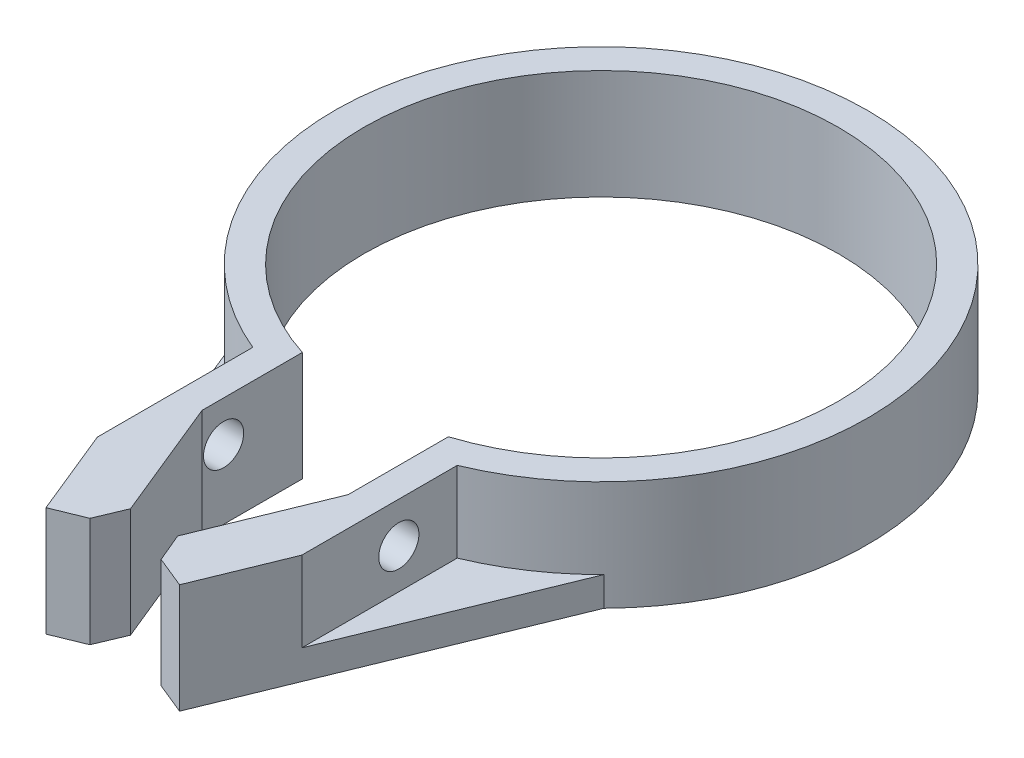
from build123d import *

# Parameters (mm, degrees)
BOSS_EXTRUDE1_DEPTH = 15
BOSS_EXTRUDE2_DEPTH = 4
CUT_EXTRUDE1_DEPTH  = 4
BOSS_EXTRUDE3_DEPTH = 15
CHAMFER1_SIZE       = 3
SKETCH6_R           = 2.75
CUT_EXTRUDE2_DEPTH  = 50


with BuildPart() as part:
    # Sketch1 → Boss-Extrude1 (new body)
    with BuildSketch(Plane(origin=(0, 0, 0), x_dir=(1, 0, 0), z_dir=(0, 1, 0))):
        with BuildLine():
            Line((-14, -33.708307581), (-14, -55))
            Line((-14, -55), (-10, -55))
            Line((-10, -55), (-10, -30.923292192))
            ThreePointArc((-10, -30.923292192), (0, 32.5), (10, -30.923292192))
            Line((10, -30.923292192), (10, -55))
            Line((10, -55), (14, -55))
            Line((14, -55), (14, -33.708307581))
            ThreePointArc((14, -33.708307581), (0, 36.5), (-14, -33.708307581))
        make_face()
    extrude(amount=BOSS_EXTRUDE1_DEPTH)

    # Sketch2 → Boss-Extrude2 (add)
    with BuildSketch(Plane.XZ):
        Polygon((-26, 22.856938123), (-14, 33.708307581), (-14, 55), (-26, 55), align=None)
        Polygon((14, 55), (26, 55), (26, 22.856938123), (14, 33.708307581), align=None)
    extrude(amount=-BOSS_EXTRUDE2_DEPTH)

    # Sketch4 → Cut-Extrude1 (cut)
    with BuildSketch(Plane(origin=(0, 4, 0), x_dir=(1, 0, 0), z_dir=(0, 1, 0))):
        Polygon((-26, -25.617376915), (-14, -55), (-32.323218547, -64.259569624), align=None)
        Polygon((14, -55), (26, -25.617376915), (31.225077356, -59.629784812), align=None)
    extrude(amount=-CUT_EXTRUDE1_DEPTH, mode=Mode.SUBTRACT)

    # Sketch5 → Boss-Extrude3 (add)
    with BuildSketch(Plane.XZ):
        Polygon((-9.146083297, 66.885067081), (-14, 55), (-10, 55), (-10, 44.654426435), (-2.09670025, 64.00606624), align=None)
        Polygon((10, 55), (14, 55), (9.146083297, 66.885067081), (2.09670025, 64.00606624), (10, 44.654426435), align=None)
    extrude(amount=-BOSS_EXTRUDE3_DEPTH)

    # Chamfer1
    chamfer1_edges = [part.edges().sort_by_distance(p)[0] for p in [
        (-2.09670025, 7.5, 64.00606624),
        (2.09670025, 7.5, 64.00606624),
    ]]
    chamfer(chamfer1_edges, length=CHAMFER1_SIZE)

    # Sketch6 → Cut-Extrude2 (cut)
    with BuildSketch(Plane(origin=(14, 0, 0), x_dir=(0, 0, -1), z_dir=(1, 0, 0))):
        with Locations((-41.708307581, 9.466509398)):
            Circle(SKETCH6_R)
    extrude(amount=-CUT_EXTRUDE2_DEPTH, mode=Mode.SUBTRACT)


solid = part.part
